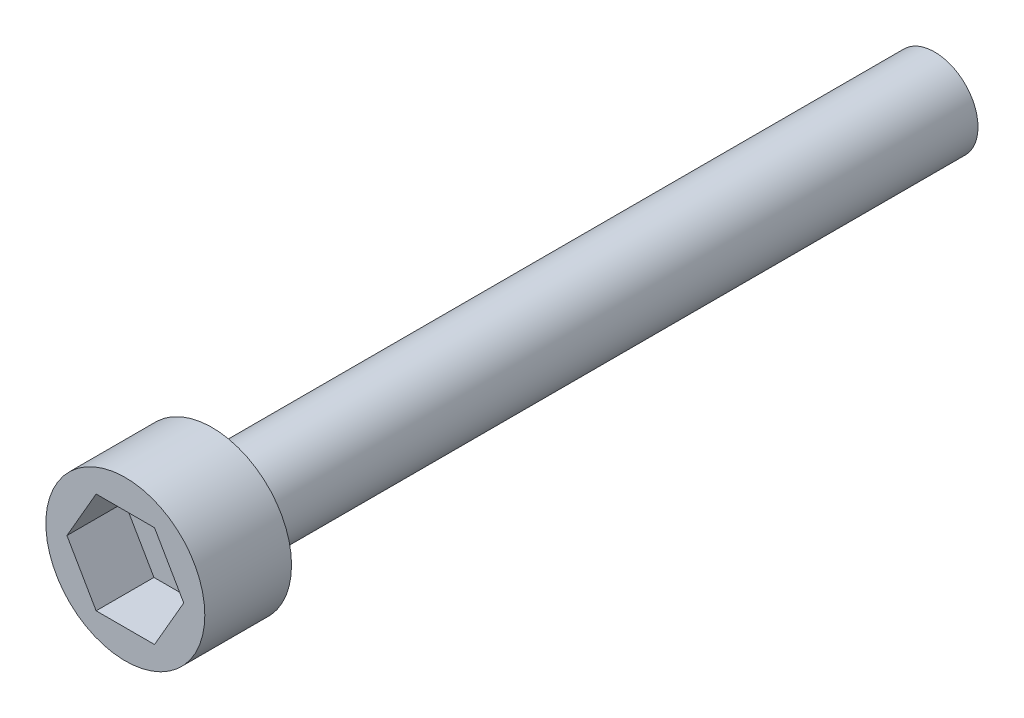
from build123d import *

# Parameters (mm, degrees)
ESQUISSE1_R             = 1.5
BOSS_EXTRU_1_DEPTH      = 25
ESQUISSE2_R             = 2.75
BOSS_EXTRU_2_DEPTH      = 3
ENL_V_MAT_EXTRU_1_DEPTH = 2


with BuildPart() as part:
    # Esquisse1 → Boss.-Extru.1 (new body)
    with BuildSketch(Plane.XY):
        Circle(ESQUISSE1_R)
    extrude(amount=BOSS_EXTRU_1_DEPTH)

    # Esquisse2 → Boss.-Extru.2 (add)
    with BuildSketch(Plane.XY.offset(25)):
        Circle(ESQUISSE2_R)
    extrude(amount=BOSS_EXTRU_2_DEPTH)

    # Esquisse3 → Enlèv. mat.-Extru.1 (cut)
    with BuildSketch(Plane.XY.offset(28)):
        Polygon((2.020725942, 0), (1.010362971, 1.75), (-1.010362971, 1.75), (-2.020725942, 0), (-1.010362971, -1.75), (1.010362971, -1.75), align=None)
    extrude(amount=-ENL_V_MAT_EXTRU_1_DEPTH, mode=Mode.SUBTRACT)


solid = part.part
